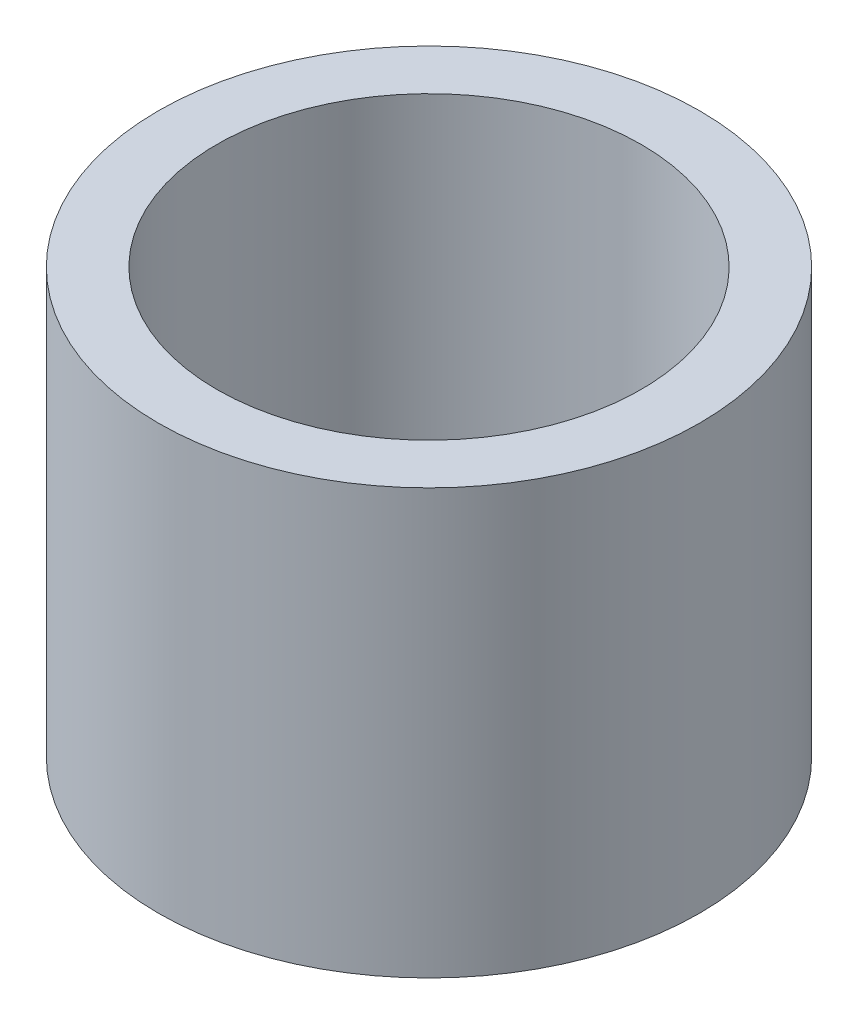
from build123d import *

# Parameters (mm, degrees)
SKETCH2_R           = 2.55
SKETCH2_R_2         = 2
BOSS_EXTRUDE1_DEPTH = 4


with BuildPart() as part:
    # Sketch2 → Boss-Extrude1 (new body)
    with BuildSketch(Plane(origin=(0, 0, 0), x_dir=(1, 0, 0), z_dir=(0, 1, 0))):
        with Locations(Location((0, 0, 0), (0, 0, 270))):
            Circle(SKETCH2_R)
        with Locations(Location((0, 0, 0), (0, 0, 270))):
            Circle(SKETCH2_R_2, mode=Mode.SUBTRACT)
    extrude(amount=BOSS_EXTRUDE1_DEPTH)


solid = part.part
